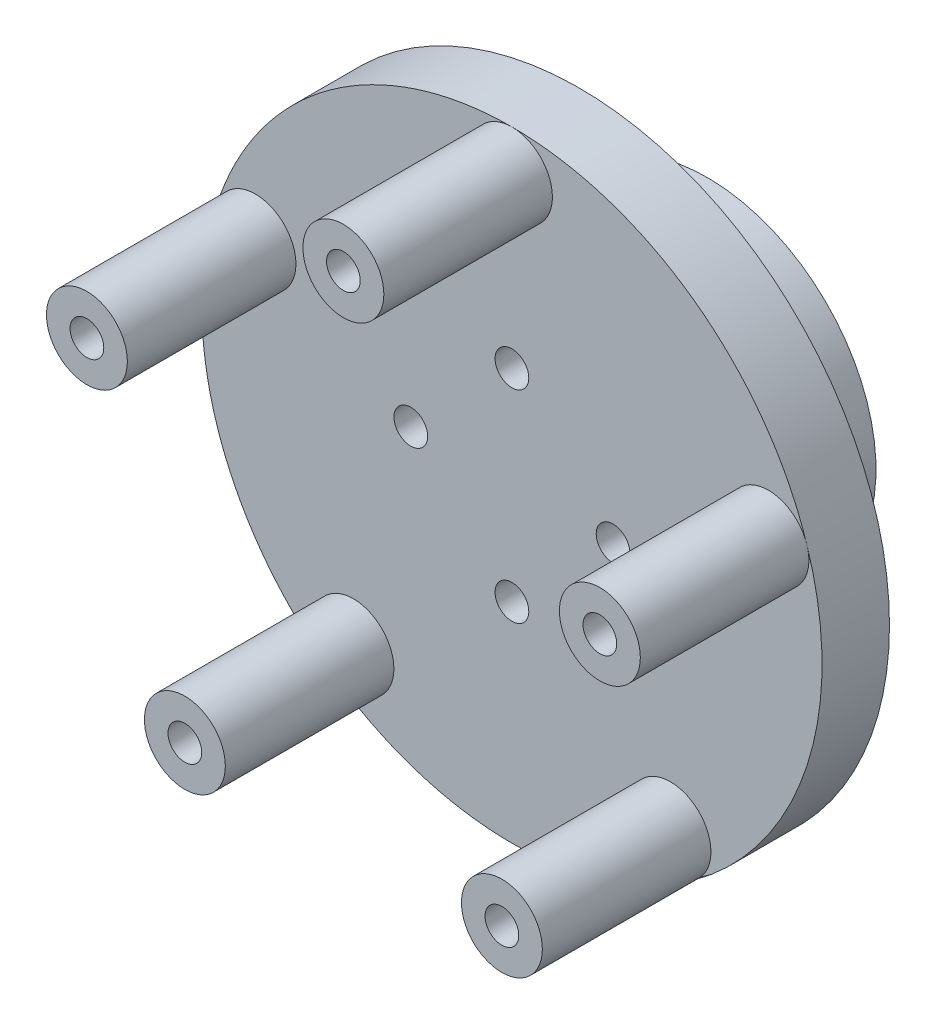
from build123d import *

# Parameters (mm, degrees)
SKETCH1_R           = 23
BOSS_EXTRUDE1_DEPTH = 5
SKETCH2_R           = 3
BOSS_EXTRUDE2_DEPTH = 12.5
SKETCH3_R           = 12.5
BOSS_EXTRUDE3_DEPTH = 9.5
M3_TAPPED_HOLE1_D   = 2.5
CIRPATTERN1_COUNT   = 5
M3_TAPPED_HOLE2_D   = 2.5


with BuildPart() as part:
    # Sketch1 → Boss-Extrude1 (new body)
    with BuildSketch(Plane.XY):
        Circle(SKETCH1_R)
    extrude(amount=BOSS_EXTRUDE1_DEPTH)

    # Sketch2 → Boss-Extrude2 (add)
    with BuildSketch(Plane.XY.offset(5)):
        with Locations(Location((0, 20, 0), (0, 0, 89.999498322))):
            Circle(SKETCH2_R)
        with Locations(Location((19.021130326, 6.180339887, 0), (0, 0, 17.999498258))):
            Circle(SKETCH2_R)
        with Locations(Location((11.755705046, -16.180339887, 0), (0, 0, 305.999498339))):
            Circle(SKETCH2_R)
        with Locations(Location((-11.755705046, -16.180339887, 0), (0, 0, 233.999498303))):
            Circle(SKETCH2_R)
        with Locations(Location((-19.021130326, 6.180339887, 0), (0, 0, 161.999499453))):
            Circle(SKETCH2_R)
    extrude(amount=BOSS_EXTRUDE2_DEPTH)

    # Sketch3 → Boss-Extrude3 (add)
    with BuildSketch(Plane(origin=(0, 0, 0), x_dir=(-1, 0, 0), z_dir=(0, 0, -1))):
        Circle(SKETCH3_R)
    extrude(amount=BOSS_EXTRUDE3_DEPTH)

    # M3 Tapped Hole1 (through all)
    with Locations(Plane.XY.offset(17.5)):
        with Locations((0, 20)):
            m3_tapped_hole1 = Hole(M3_TAPPED_HOLE1_D / 2)

    # CirPattern1: M3 Tapped Hole1 ×5 about axis
    cirpattern1_axis = Axis((0, 0, 0), (0, 0, 1))
    for i in range(1, CIRPATTERN1_COUNT):
        add(m3_tapped_hole1.rotate(cirpattern1_axis, i * 360 / CIRPATTERN1_COUNT), mode=Mode.SUBTRACT)

    # M3 Tapped Hole2 (through all)
    with Locations(Plane(origin=(0, 0, -9.5), x_dir=(-1, 0, 0), z_dir=(0, 0, -1))):
        with Locations((-7.5, 0), (0, 7.5), (7.5, 0), (0, -7.5)):
            Hole(M3_TAPPED_HOLE2_D / 2)


solid = part.part
